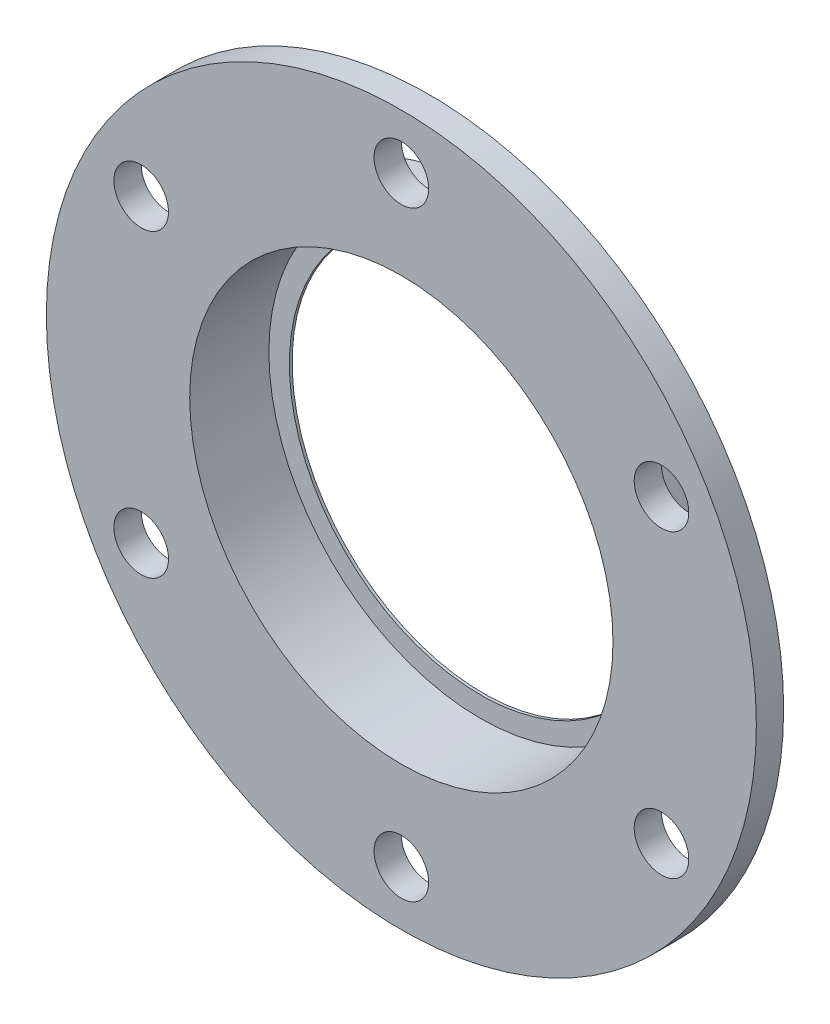
from build123d import *

# Parameters (mm, degrees)
SKETCH1_R           = 45
BOSS_EXTRUDE1_DEPTH = 15
SKETCH2_R           = 38.75
CUT_EXTRUDE1_DEPTH  = 14.5
SKETCH3_R           = 35
CUT_EXTRUDE2_DEPTH  = 66.270590621
BOSS_EXTRUDE2_START = -5
SKETCH4_R           = 65
SKETCH4_R_2         = 45
BOSS_EXTRUDE2_DEPTH = 5
SKETCH5_R           = 5
CUT_EXTRUDE3_DEPTH  = 93.466210045


with BuildPart() as part:
    # Sketch1 → Boss-Extrude1 (new body)
    with BuildSketch(Plane.XY):
        Circle(SKETCH1_R)
    extrude(amount=BOSS_EXTRUDE1_DEPTH)

    # Sketch2 → Cut-Extrude1 (cut)
    with BuildSketch(Plane.XY.offset(15)):
        Circle(SKETCH2_R)
    extrude(amount=-CUT_EXTRUDE1_DEPTH, mode=Mode.SUBTRACT)

    # Sketch3 → Cut-Extrude2 (cut, through all)
    with BuildSketch(Plane.XY.offset(0.5)):
        Circle(SKETCH3_R)
    extrude(amount=-CUT_EXTRUDE2_DEPTH, mode=Mode.SUBTRACT)

    # Sketch4 → Boss-Extrude2 (add)
    with BuildSketch(Plane.XY.offset(15).offset(BOSS_EXTRUDE2_START)):
        Circle(SKETCH4_R)
        Circle(SKETCH4_R_2, mode=Mode.SUBTRACT)
    extrude(amount=BOSS_EXTRUDE2_DEPTH)

    # Sketch5 → Cut-Extrude3 (cut, through all)
    with BuildSketch(Plane(origin=(0, 0, 10), x_dir=(-1, 0, 0), z_dir=(0, 0, -1))):
        with Locations((0, 55)):
            Circle(SKETCH5_R)
        with Locations((47.631397208, 27.5)):
            Circle(SKETCH5_R)
        with Locations((47.631397208, -27.5)):
            Circle(SKETCH5_R)
        with Locations((0, -55)):
            Circle(SKETCH5_R)
        with Locations((-47.631397208, -27.5)):
            Circle(SKETCH5_R)
        with Locations((-47.631397208, 27.5)):
            Circle(SKETCH5_R)
    extrude(amount=-CUT_EXTRUDE3_DEPTH, mode=Mode.SUBTRACT)


solid = part.part
